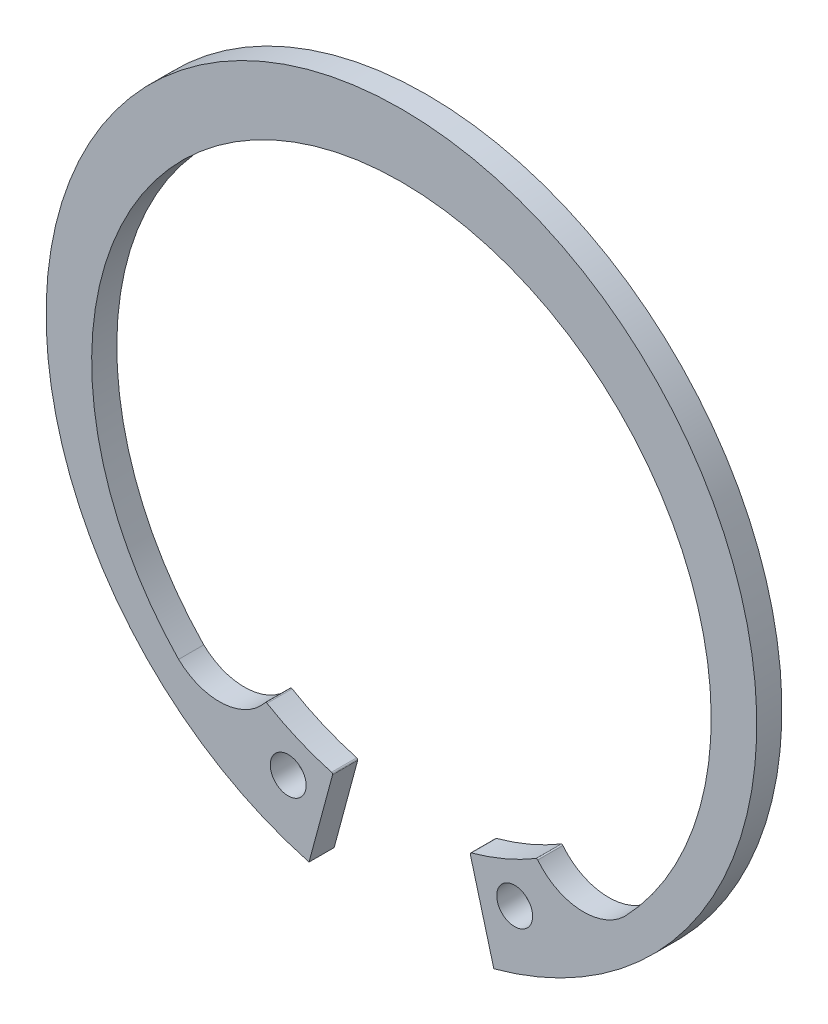
from build123d import *

# Parameters (mm, degrees)
BODYSKE_R    = 1.25
BODY_DEPTH   = 1.75
MODLUGSKE_R  = 1.25
MODLUG_DEPTH = 1.75


with BuildPart() as part:
    # BodySke → Body (new body)
    with BuildSketch(Plane.XY):
        with BuildLine():
            Line((6.436111652, -23.898513904), (5.400081715, -20.051536536))
            ThreePointArc((5.400081715, -20.051536536), (6.699668105, -17.096735495), (9.864304114, -17.733016019))
            ThreePointArc((9.864304114, -17.733016019), (11.581275555, -18.645865936), (13.446997724, -18.097808741))
            ThreePointArc((13.446997724, -18.097808741), (0, 20.35), (-13.446997724, -18.097808741))
            ThreePointArc((-13.446997724, -18.097808741), (-11.581275555, -18.645865936), (-9.864304114, -17.733016019))
            ThreePointArc((-9.864304114, -17.733016019), (-6.699668105, -17.096735495), (-5.400081715, -20.051536536))
            Line((-5.400081715, -20.051536536), (-6.436111652, -23.898513904))
            ThreePointArc((-6.436111652, -23.898513904), (0, 24.75), (6.436111652, -23.898513904))
        make_face()
        with Locations((7.886492758, -19.38192088)):
            Circle(BODYSKE_R, mode=Mode.SUBTRACT)
        with Locations((-7.886492758, -19.38192088)):
            Circle(BODYSKE_R, mode=Mode.SUBTRACT)
    extrude(amount=-BODY_DEPTH)

    # ModLugSke → ModLug (add, through all)
    # profile 1 of 2: a face of its own
    with BuildSketch(Plane.XY):
        with BuildLine():
            Line((6.436111652, -23.898513904), (4.797758213, -17.814994138))
            ThreePointArc((4.797758213, -17.814994138), (4.807517042, -17.739334665), (4.867790397, -17.692572358))
            ThreePointArc((4.867790397, -17.692572358), (7.17874809, -16.887512424), (9.362030953, -15.78210621))
            ThreePointArc((9.362030953, -15.78210621), (9.431060859, -15.76974753), (9.491233364, -15.805763285))
            ThreePointArc((9.491233364, -15.805763285), (12.415098782, -17.336547673), (15.517305658, -16.210225194))
            Line((15.517305658, -16.210225194), (17.114597599, -17.878843615))
            ThreePointArc((17.114597599, -17.878843615), (12.153932868, -21.56025083), (6.436111652, -23.898513904))
        make_face()
        with Locations((7.886492758, -19.38192088)):
            Circle(MODLUGSKE_R, mode=Mode.SUBTRACT)
    # profile 2 of 2: a face of its own
    with BuildSketch(Plane.XY):
        with BuildLine():
            Line((-6.436111652, -23.898513904), (-4.797758213, -17.814994138))
            ThreePointArc((-4.797758213, -17.814994138), (-4.807517042, -17.739334665), (-4.867790397, -17.692572358))
            ThreePointArc((-4.867790397, -17.692572358), (-7.17874809, -16.887512424), (-9.362030953, -15.78210621))
            ThreePointArc((-9.362030953, -15.78210621), (-9.431060859, -15.76974753), (-9.491233364, -15.805763285))
            ThreePointArc((-9.491233364, -15.805763285), (-12.415098782, -17.336547673), (-15.517305658, -16.210225194))
            Line((-15.517305658, -16.210225194), (-17.114597599, -17.878843615))
            ThreePointArc((-17.114597599, -17.878843615), (-12.153932868, -21.56025083), (-6.436111652, -23.898513904))
        make_face()
        with Locations((-7.886492758, -19.38192088)):
            Circle(MODLUGSKE_R, mode=Mode.SUBTRACT)
    extrude(amount=-MODLUG_DEPTH)


solid = part.part
